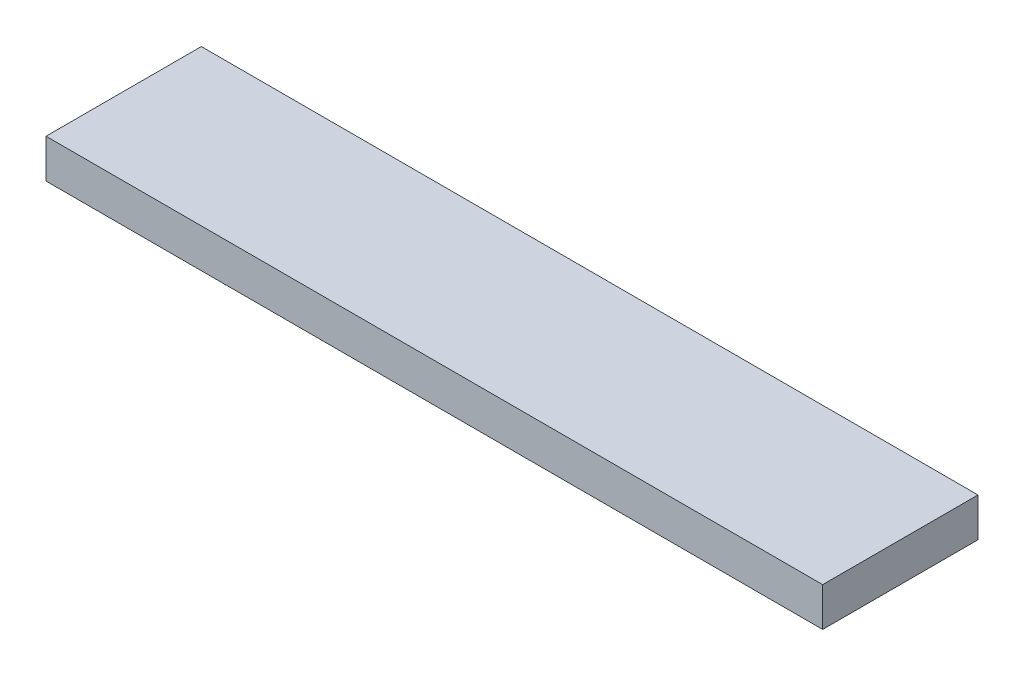
from build123d import *

# Parameters (mm, degrees)
SKETCH1_W           = 127
SKETCH1_H           = 25.4
BOSS_EXTRUDE1_DEPTH = 6.35


with BuildPart() as part:
    # Sketch1 → Boss-Extrude1 (new body)
    with BuildSketch(Plane(origin=(0, 0, 0), x_dir=(1, 0, 0), z_dir=(0, 1, 0))):
        with Locations((-24.681132075, 0)):
            Rectangle(SKETCH1_W, SKETCH1_H)
    extrude(amount=BOSS_EXTRUDE1_DEPTH)


solid = part.part
